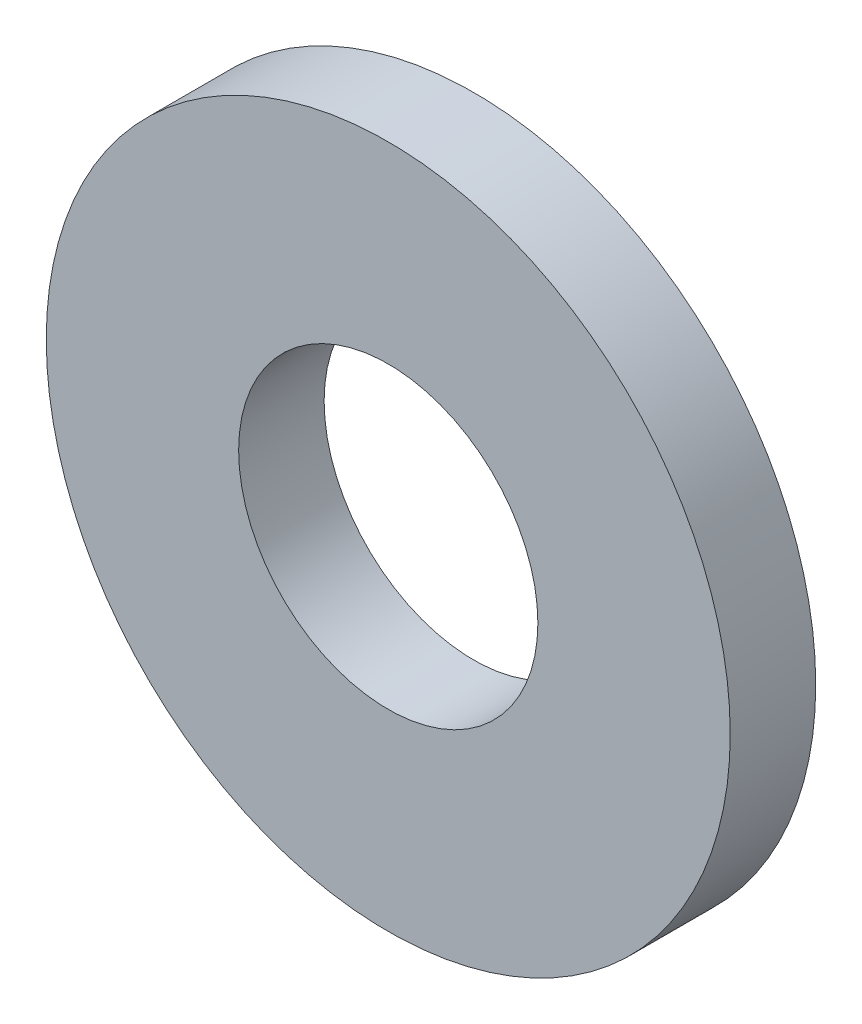
from build123d import *

# Parameters (mm, degrees)
SKETCH1_R           = 4
SKETCH1_R_2         = 1.75
BOSS_EXTRUDE1_DEPTH = 1


with BuildPart() as part:
    # Sketch1 → Boss-Extrude1 (new body)
    with BuildSketch(Plane.XY):
        Circle(SKETCH1_R)
        Circle(SKETCH1_R_2, mode=Mode.SUBTRACT)
    extrude(amount=BOSS_EXTRUDE1_DEPTH)


solid = part.part
